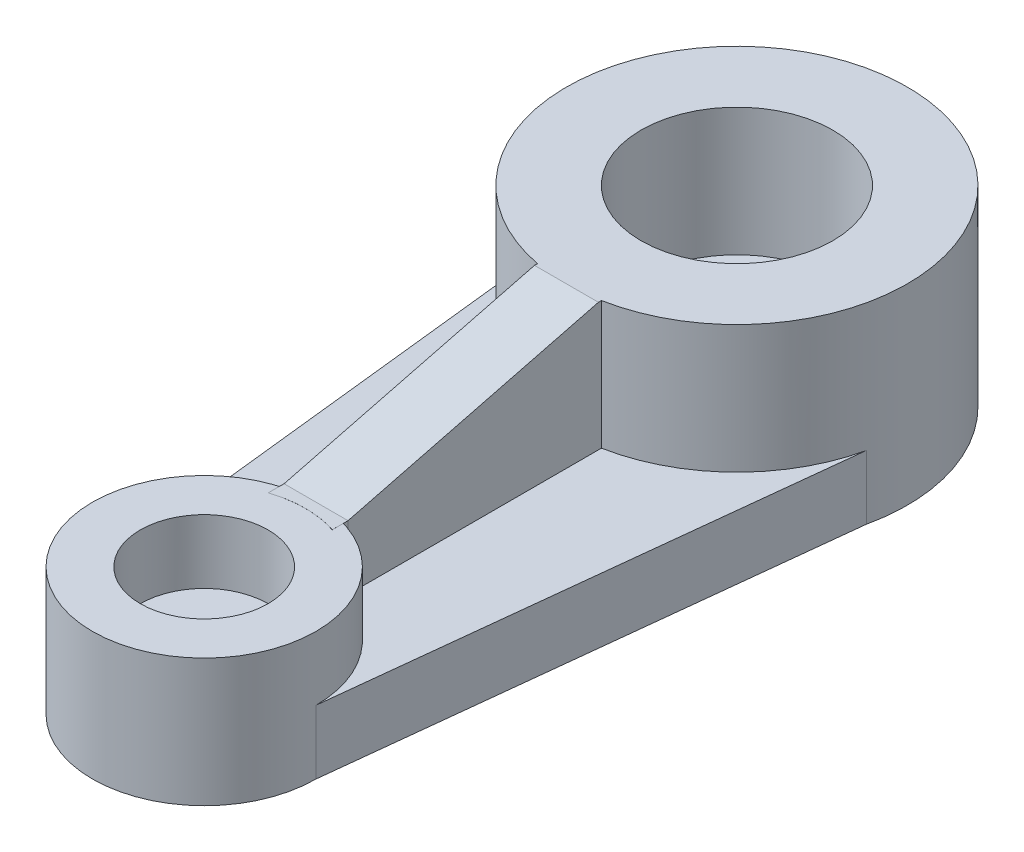
from build123d import *

# Parameters (mm, degrees)
SKETCH1_R                 = 32
SKETCH1_R_2               = 18
BOSS_EXTRUDE1_DEPTH       = 36
SKETCH2_R                 = 21
SKETCH2_R_2               = 12
BOSS_EXTRUDE2_DEPTH       = 24
BOSS_EXTRUDE5_DEPTH       = 12
BOSS_EXTRUDE8_DEPTH       = 6
BOSS_EXTRUDE12_REACH      = 123.135
BOSS_EXTRUDE12_END_RADIUS = 19
SKETCH9_W                 = 12
SKETCH9_H                 = 12.000135411
SKETCH10_W                = 12
SKETCH10_H                = 24
BOSS_EXTRUDE13_DEPTH      = 0.567533


with BuildPart() as part:
    # Sketch1 → Boss-Extrude1 (new body)
    with BuildSketch(Plane(origin=(0, 0, 0), x_dir=(1, 0, 0), z_dir=(0, 1, 0))):
        with Locations(Location((0, 100, 0), (0, 0, 270))):
            Circle(SKETCH1_R)
        with Locations(Location((0, 100, 0), (0, 0, 270))):
            Circle(SKETCH1_R_2, mode=Mode.SUBTRACT)
    extrude(amount=BOSS_EXTRUDE1_DEPTH)



with BuildPart() as body_2:
    # Sketch2 → Boss-Extrude2 (new body)
    with BuildSketch(Plane(origin=(0, 0, 0), x_dir=(1, 0, 0), z_dir=(0, 1, 0))):
        with Locations(Location((0, 0, 0), (0, 0, 270))):
            Circle(SKETCH2_R)
        with Locations(Location((0, 0, 0), (0, 0, 270))):
            Circle(SKETCH2_R_2, mode=Mode.SUBTRACT)
    extrude(amount=BOSS_EXTRUDE2_DEPTH)


with BuildPart() as part_1:
    add(part.part)

    add(body_2.part)  # Boss-Extrude5 merges body 2
    # Sketch7 → Boss-Extrude5 (add)
    with BuildSketch(Plane(origin=(0, 0, 0), x_dir=(-1, 0, 0), z_dir=(0, -1, 0))):
        with BuildLine():
            Line((21, 0), (31.234858216, 93.044165596))
            ThreePointArc((31.234858216, 93.044165596), (0, 132), (-31.234858216, 93.044165596))
            Line((-31.234858216, 93.044165596), (-21, 0))
            ThreePointArc((-21, 0), (0, -21), (21, 0))
        make_face()
    extrude(amount=-BOSS_EXTRUDE5_DEPTH)



with BuildPart() as body_2_2:
    # Sketch8 → Boss-Extrude8 (new, symmetric)
    with BuildSketch(Plane(origin=(0, 0, 0), x_dir=(0, 0, -1), z_dir=(1, 0, 0))):
        Polygon((68, 12), (20.942992135, 12), (21, 24), (68, 36), align=None)
    extrude(amount=BOSS_EXTRUDE8_DEPTH, both=True)


with BuildPart() as body_3:
    # Boss-Extrude12: up to this cylinder (the profile starts outside it)
    boss_extrude12_end = Plane(origin=(0, 18, 0), z_dir=(0, -1, 0)) * Cylinder(BOSS_EXTRUDE12_END_RADIUS, 285.27, mode=Mode.PRIVATE)
    # Sketch9 → Boss-Extrude12 (new, up to the surface)
    with BuildSketch(Plane(origin=(0, -0.099219875, -20.88551291), x_dir=(1, 0, 0), z_dir=(0, 0.0047506018218450435, 0.9999887158274989)), mode=Mode.PRIVATE) as boss_extrude12_sk1:
        with Locations((0, 18.099424112)):
            Rectangle(SKETCH9_W, SKETCH9_H)
    boss_extrude12_tool1 = extrude(boss_extrude12_sk1.sketch, amount=BOSS_EXTRUDE12_REACH, mode=Mode.PRIVATE) - boss_extrude12_end
    add(boss_extrude12_tool1.solids().sort_by_distance((0, 18, -20.971496))[0])


with BuildPart() as part_2:
    add(part_1.part)

    add(body_2_2.part)  # Boss-Extrude13 merges body 2 2
    # Sketch10 → Boss-Extrude13 (add)
    with BuildSketch(Plane(origin=(0, 0, -68), x_dir=(-1, 0, 0), z_dir=(0, 0, -1))):
        with Locations((0, 24)):
            Rectangle(SKETCH10_W, SKETCH10_H)
    extrude(amount=BOSS_EXTRUDE13_DEPTH)


solid = Compound([body_3.part, part_2.part])
